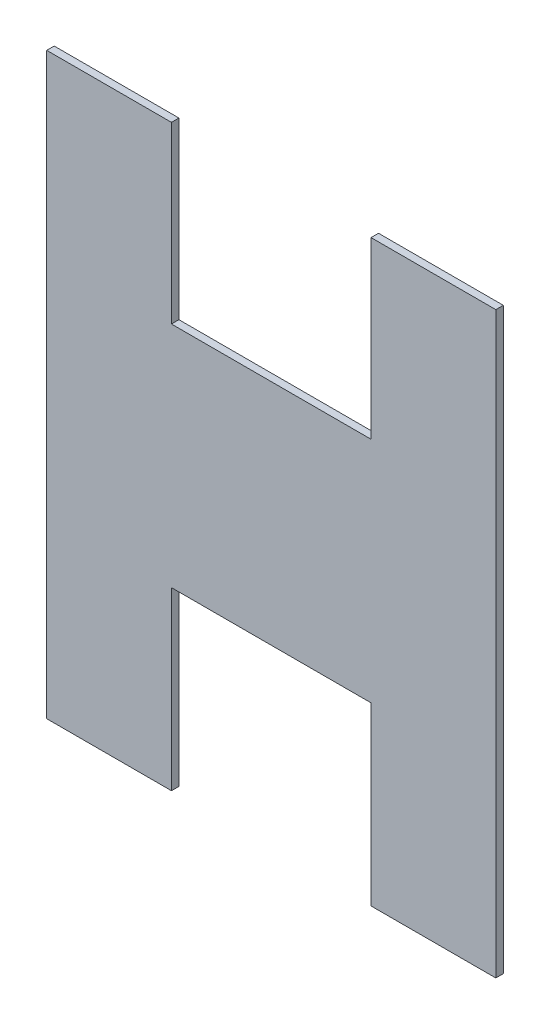
from build123d import *

# Parameters (mm, degrees)
BOSS_EXTRU_1_DEPTH = 3


with BuildPart() as part:
    # Esquisse1 → Boss.-Extru.1 (new body)
    with BuildSketch(Plane.XY):
        Polygon((-40, 83.256436311), (-40, 13.256436311), (40, 13.256436311), (40, 83.256436311), (90, 83.256436311), (90, -148.743563689), (40, -148.743563689), (40, -78.243563689), (-40, -78.243563689), (-40, -148.743563689), (-90, -148.743563689), (-90, 83.256436311), align=None)
    extrude(amount=BOSS_EXTRU_1_DEPTH)


solid = part.part
